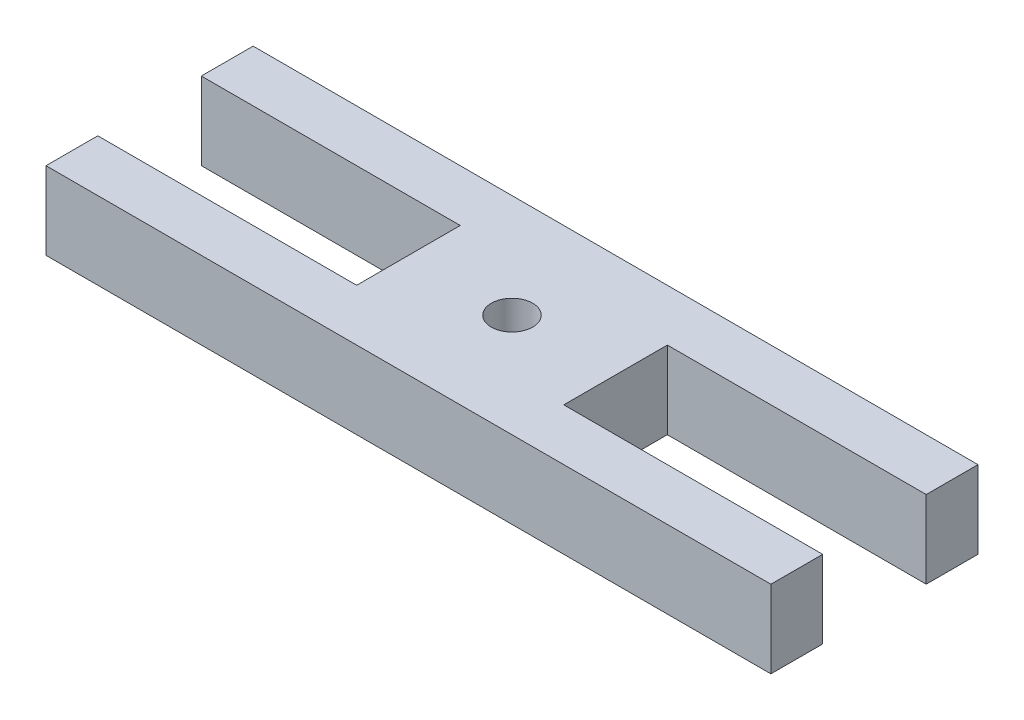
from build123d import *

# Parameters (mm, degrees)
SKETCH1_R           = 0.4
BOSS_EXTRUDE3_DEPTH = 1.5


with BuildPart() as part:
    # Sketch1 → Boss-Extrude3 (new body)
    with BuildSketch(Plane(origin=(0, 0, 0), x_dir=(1, 0, 0), z_dir=(0, 1, 0))):
        Polygon((-20.583073889, 25.40617028), (-20.583073889, 26.40617028), (-34.583073889, 26.40617028), (-34.583073889, 25.40617028), (-29.583073889, 25.40617028), (-29.583073889, 23.40617028), (-34.583073889, 23.40617028), (-34.583073889, 22.40617028), (-20.583073889, 22.40617028), (-20.583073889, 23.40617028), (-25.583073889, 23.40617028), (-25.583073889, 25.40617028), align=None)
        with Locations(Location((-27.583073889, 24.40617028, 0), (0, 0, 270))):
            Circle(SKETCH1_R, mode=Mode.SUBTRACT)
    extrude(amount=BOSS_EXTRUDE3_DEPTH)


solid = part.part
